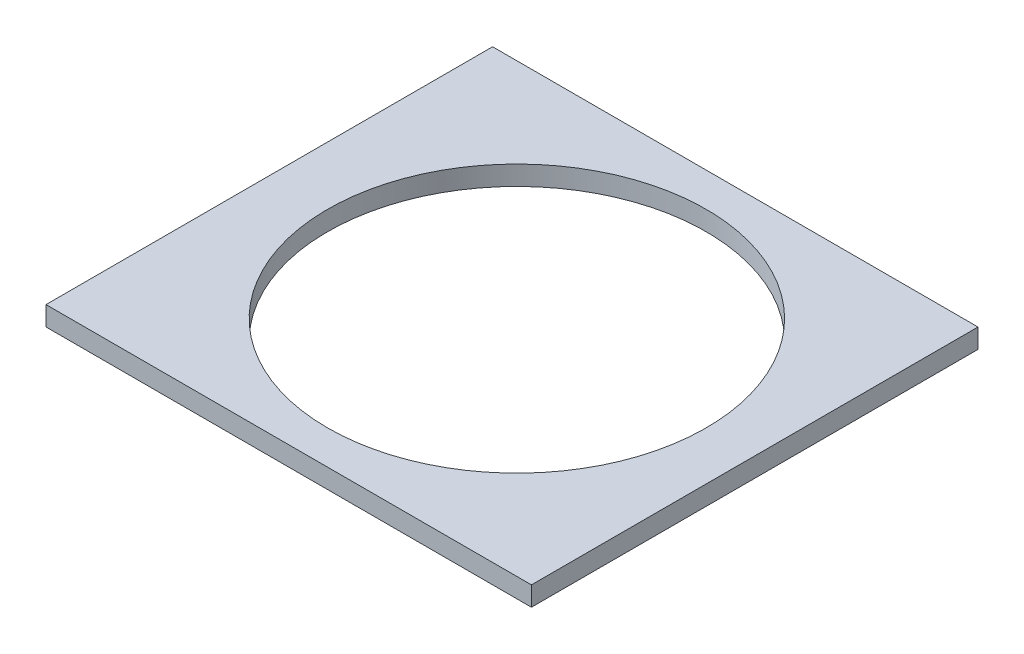
from build123d import *

# Parameters (mm, degrees)
SKETCH_1_W          = 25
SKETCH_1_H          = 23
EXTRUDE_1_DEPTH     = 12
CUT_EXTRUDE_START   = 1
SKETCH_2_W          = 25
SKETCH_2_H          = 21
CUT_EXTRUDE_1_DEPTH = 11
EXTRUDE_START       = 12
SKETCH_6_W          = 25
SKETCH_6_H          = 23
EXTRUDE_3_DEPTH     = 1
CUT_EXTRUDE_START_2 = 13
SKETCH_8_R          = 9.75
CUT_EXTRUDE_2_DEPTH = 1
SKETCH_10_W         = 25
SKETCH_10_H         = 23
CUT_EXTRUDE_4_DEPTH = 12


with BuildPart() as part:
    # 스케치1 → 보스-돌출1 (new body)
    with BuildSketch(Plane(origin=(0, 0, 0), x_dir=(1, 0, 0), z_dir=(0, 1, 0))):
        Rectangle(SKETCH_1_W, SKETCH_1_H)
    extrude(amount=EXTRUDE_1_DEPTH)

    # 스케치2 → 컷-돌출1 (cut)
    with BuildSketch(Plane(origin=(0, 0, 0), x_dir=(1, 0, 0), z_dir=(0, 1, 0)).offset(CUT_EXTRUDE_START)):
        with Locations((1, 0)):
            Rectangle(SKETCH_2_W, SKETCH_2_H)
    extrude(amount=CUT_EXTRUDE_1_DEPTH, mode=Mode.SUBTRACT)

    # 스케치10 → 컷-돌출4 (cut)
    with BuildSketch(Plane.XZ):
        Rectangle(SKETCH_10_W, SKETCH_10_H)
    extrude(amount=-CUT_EXTRUDE_4_DEPTH, mode=Mode.SUBTRACT)


with BuildPart() as body_2:
    # 스케치6 → 보스-돌출3 (new body)
    with BuildSketch(Plane(origin=(0, 0, 0), x_dir=(1, 0, 0), z_dir=(0, 1, 0)).offset(EXTRUDE_START)):
        Rectangle(SKETCH_6_W, SKETCH_6_H)
    extrude(amount=EXTRUDE_3_DEPTH)

    # 스케치8 → 컷-돌출2 (cut)
    with BuildSketch(Plane(origin=(0, 0, 0), x_dir=(1, 0, 0), z_dir=(0, 1, 0)).offset(CUT_EXTRUDE_START_2)):
        with Locations(Location((0.25, 0, 0), (0, 0, 270))):
            Circle(SKETCH_8_R)
    extrude(amount=-CUT_EXTRUDE_2_DEPTH, mode=Mode.SUBTRACT)


solid = body_2.part
